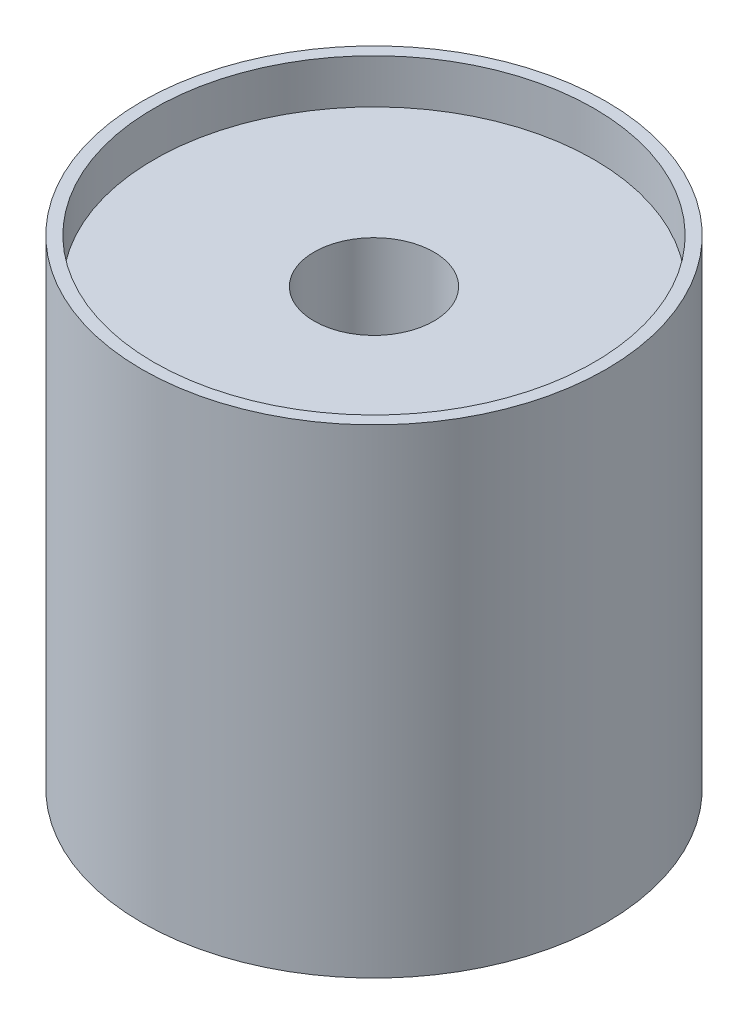
from build123d import *

# Parameters (mm, degrees)
SKETCH1_R           = 49.2125
BOSS_EXTRUDE1_DEPTH = 101.6
SKETCH2_R           = 12.7
CUT_EXTRUDE1_DEPTH  = 45.72
SKETCH3_R           = 46.654307407
CUT_EXTRUDE2_DEPTH  = 9.398


with BuildPart() as part:
    # Sketch1 → Boss-Extrude1 (new body)
    with BuildSketch(Plane(origin=(0, 0, 0), x_dir=(1, 0, 0), z_dir=(0, 1, 0))):
        with Locations(Location((0, 0, 0), (0, 0, 270))):
            Circle(SKETCH1_R)
    extrude(amount=BOSS_EXTRUDE1_DEPTH)

    # Sketch2 → Cut-Extrude1 (cut)
    with BuildSketch(Plane(origin=(0, 101.6, 0), x_dir=(1, 0, 0), z_dir=(0, 1, 0))):
        with Locations(Location((0, 0, 0), (0, 0, 270))):
            Circle(SKETCH2_R)
    extrude(amount=-CUT_EXTRUDE1_DEPTH, mode=Mode.SUBTRACT)

    # Sketch3 → Cut-Extrude2 (cut)
    with BuildSketch(Plane(origin=(0, 101.6, 0), x_dir=(1, 0, 0), z_dir=(0, 1, 0))):
        with Locations(Location((0, 0, 0), (0, 0, 270))):
            Circle(SKETCH3_R)
    extrude(amount=-CUT_EXTRUDE2_DEPTH, mode=Mode.SUBTRACT)


solid = part.part
